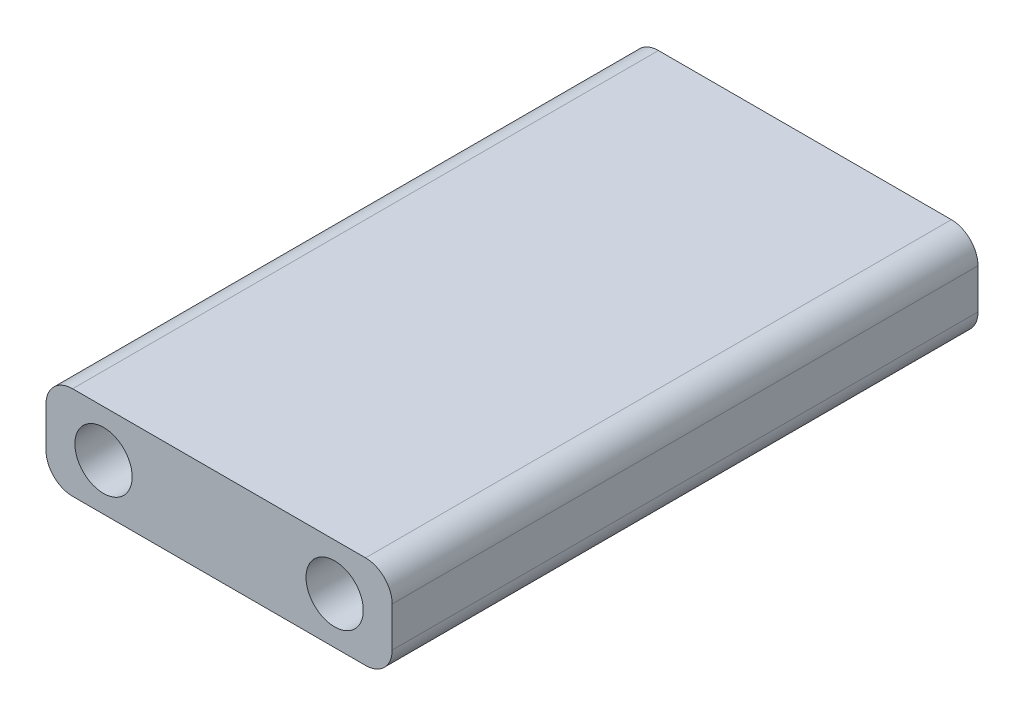
from build123d import *

# Parameters (mm, degrees)
SZKIC1_W                    = 26
SZKIC1_H                    = 44
DODANIE_WYCI_GNI_CIE1_DEPTH = 7
SZKIC2_R                    = 2.15
WYTNIJ_WYCI_GNI_CIE1_DEPTH  = 5
ZAOKR_GLENIE1_R             = 2


with BuildPart() as part:
    # Szkic1 → Dodanie-wyciągnięcie1 (new body)
    with BuildSketch(Plane(origin=(0, 0, 0), x_dir=(1, 0, 0), z_dir=(0, 1, 0))):
        Rectangle(SZKIC1_W, SZKIC1_H)
    extrude(amount=DODANIE_WYCI_GNI_CIE1_DEPTH)

    # Szkic2 → Wytnij-wyciągnięcie1 (cut)
    with BuildSketch(Plane.XY.offset(22)):
        with Locations((-8.68, 3.5)):
            Circle(SZKIC2_R)
        with Locations(Location((8.68, 3.5, 0), (0, 0, 180))):
            Circle(SZKIC2_R)
    wytnij_wyci_gni_cie1 = extrude(amount=-WYTNIJ_WYCI_GNI_CIE1_DEPTH, mode=Mode.SUBTRACT)

    # Lustro1: Wytnij-wyciągnięcie1 across plane
    add(wytnij_wyci_gni_cie1.mirror(Plane.XY), mode=Mode.SUBTRACT)

    # Zaokrąglenie1
    zaokr_glenie1_edges = [part.edges().sort_by_distance(p)[0] for p in [
        (-13, 7, 0),
        (13, 7, 0),
        (-13, 0, 0),
        (13, 0, 0),
    ]]
    fillet(zaokr_glenie1_edges, radius=ZAOKR_GLENIE1_R)


solid = part.part
